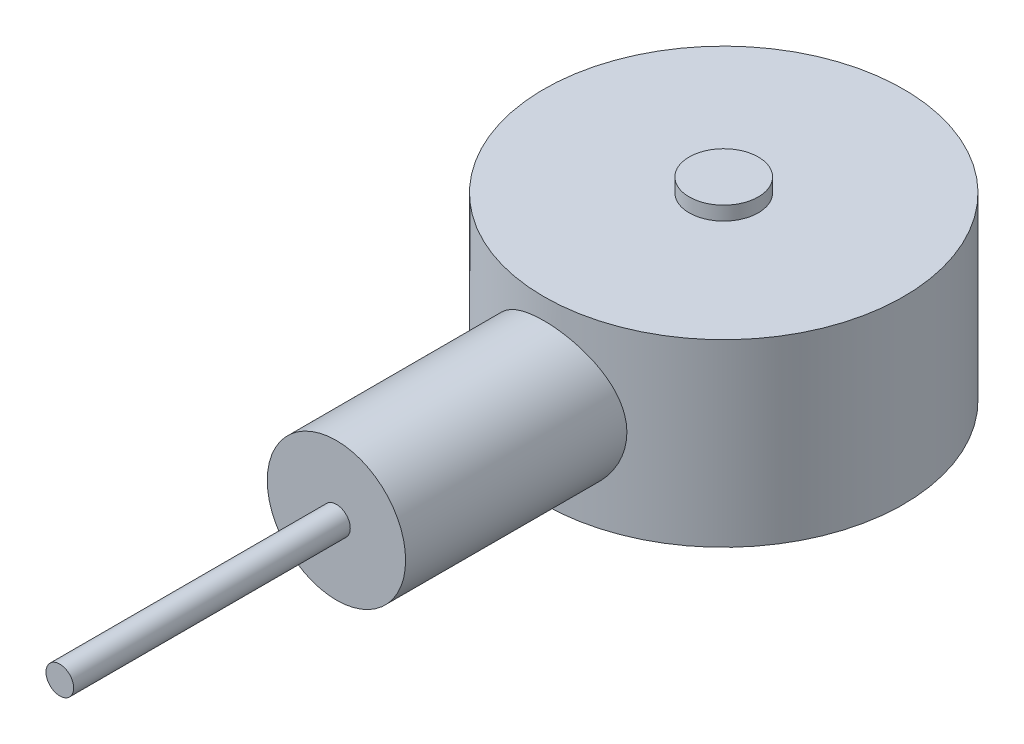
from build123d import *

# Parameters (mm, degrees)
SKETCH1_R           = 6.5
BOSS_EXTRUDE1_DEPTH = 6.5
SKETCH2_R           = 1.25
BOSS_EXTRUDE2_DEPTH = 0.5
SKETCH4_R           = 2.5
BOSS_EXTRUDE4_DEPTH = 14
SKETCH5_R           = 0.5
BOSS_EXTRUDE5_DEPTH = 10


with BuildPart() as part:
    # Sketch1 → Boss-Extrude1 (new body)
    with BuildSketch(Plane(origin=(0, 0, 0), x_dir=(1, 0, 0), z_dir=(0, 1, 0))):
        with Locations(Location((0, 0, 0), (0, 0, 90))):
            Circle(SKETCH1_R)
    extrude(amount=BOSS_EXTRUDE1_DEPTH)

    # Sketch2 → Boss-Extrude2 (add)
    with BuildSketch(Plane(origin=(0, 6.5, 0), x_dir=(1, 0, 0), z_dir=(0, 1, 0))):
        with Locations(Location((0, 0, 0), (0, 0, 270))):
            Circle(SKETCH2_R)
    extrude(amount=BOSS_EXTRUDE2_DEPTH)

    # Sketch4 → Boss-Extrude4 (add)
    with BuildSketch(Plane.XY):
        with Locations(Location((0, 3.25, 0), (0, 0, 180))):
            Circle(SKETCH4_R)
    extrude(amount=BOSS_EXTRUDE4_DEPTH)

    # Sketch5 → Boss-Extrude5 (add)
    with BuildSketch(Plane.XY.offset(14)):
        with Locations((0, 3.25)):
            Circle(SKETCH5_R)
    extrude(amount=BOSS_EXTRUDE5_DEPTH)


solid = part.part
